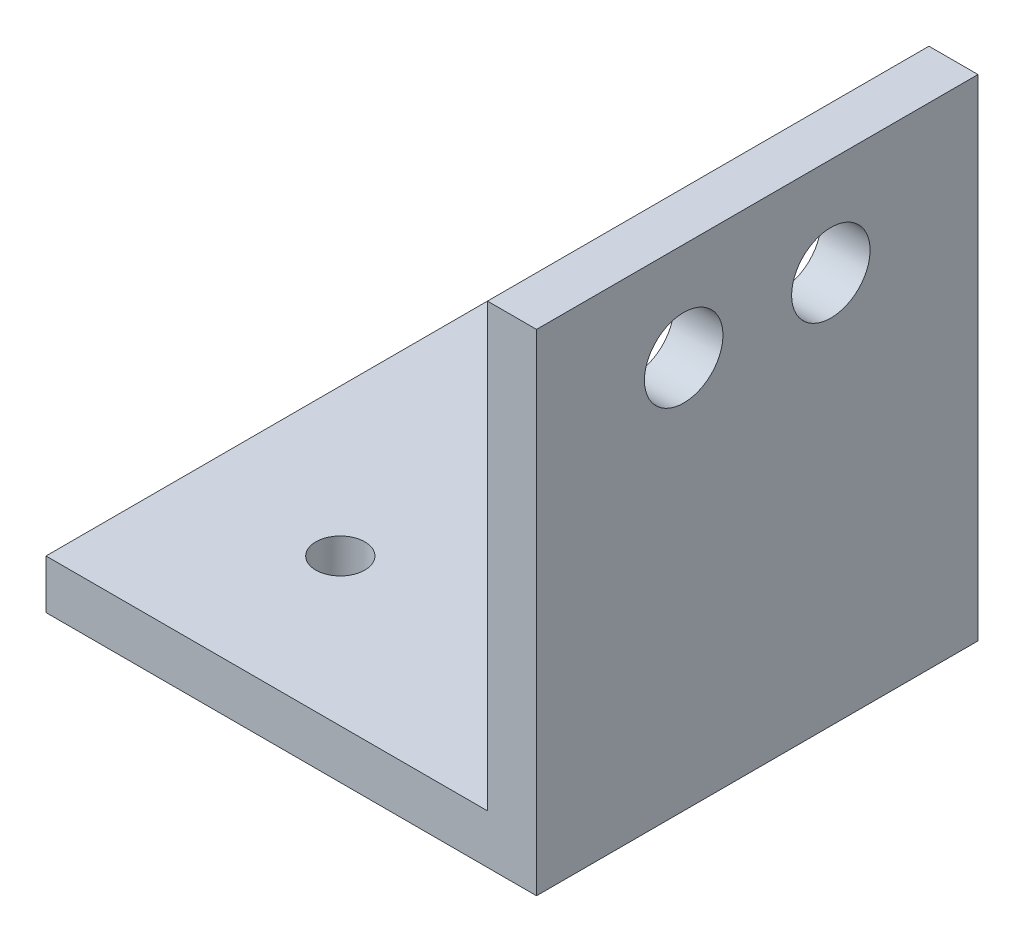
from build123d import *

# Parameters (mm, degrees)
BOSS_EXTRUDE1_DEPTH = 45
SKETCH2_R           = 4
CUT_EXTRUDE1_DEPTH  = 81.932070281
SKETCH3_R           = 2.5
CUT_EXTRUDE3_DEPTH  = 84.815273071


with BuildPart() as part:
    # Sketch1 → Boss-Extrude1 (new body)
    with BuildSketch(Plane.XY):
        Polygon((0, 0), (0, 50), (-5, 50), (-5, 5), (-50, 5), (-50, 0), align=None)
    extrude(amount=BOSS_EXTRUDE1_DEPTH)

    # Sketch2 → Cut-Extrude1 (cut, through all)
    with BuildSketch(Plane.ZY.offset(5)):
        with Locations((15, 40)):
            Circle(SKETCH2_R)
        with Locations((30, 40)):
            Circle(SKETCH2_R)
    extrude(amount=-CUT_EXTRUDE1_DEPTH, mode=Mode.SUBTRACT)

    # Sketch3 → Cut-Extrude3 (cut, through all)
    with BuildSketch(Plane(origin=(0, 0, 0), x_dir=(1, 0, 0), z_dir=(0, 1, 0))):
        with Locations((-35, -30)):
            Circle(SKETCH3_R)
        with Locations((-20, -15)):
            Circle(SKETCH3_R)
    extrude(amount=CUT_EXTRUDE3_DEPTH, mode=Mode.SUBTRACT)


solid = part.part
